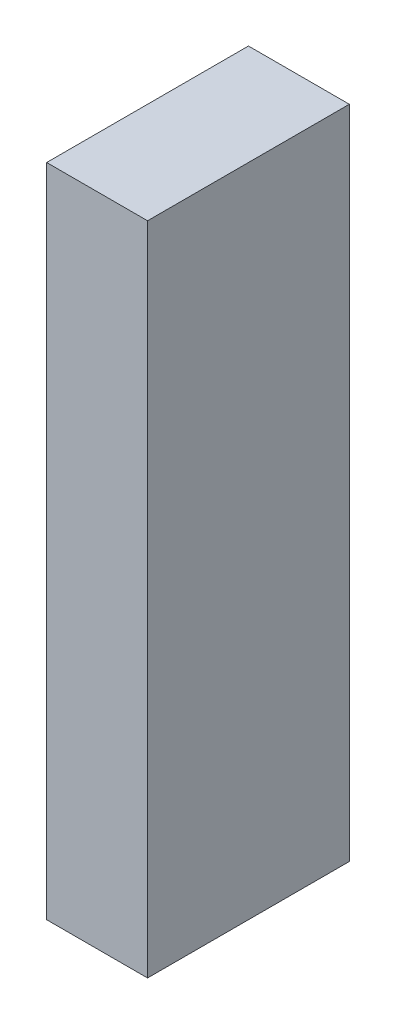
from build123d import *

# Parameters (mm, degrees)
SKETCH1_W           = 50.8
SKETCH1_H           = 101.6
BOSS_EXTRUDE1_DEPTH = 330.2


with BuildPart() as part:
    # Sketch1 → Boss-Extrude1 (new body)
    with BuildSketch(Plane(origin=(0, 0, 0), x_dir=(1, 0, 0), z_dir=(0, 1, 0))):
        with Locations((25.4, 50.8)):
            Rectangle(SKETCH1_W, SKETCH1_H)
    extrude(amount=BOSS_EXTRUDE1_DEPTH)


solid = part.part
